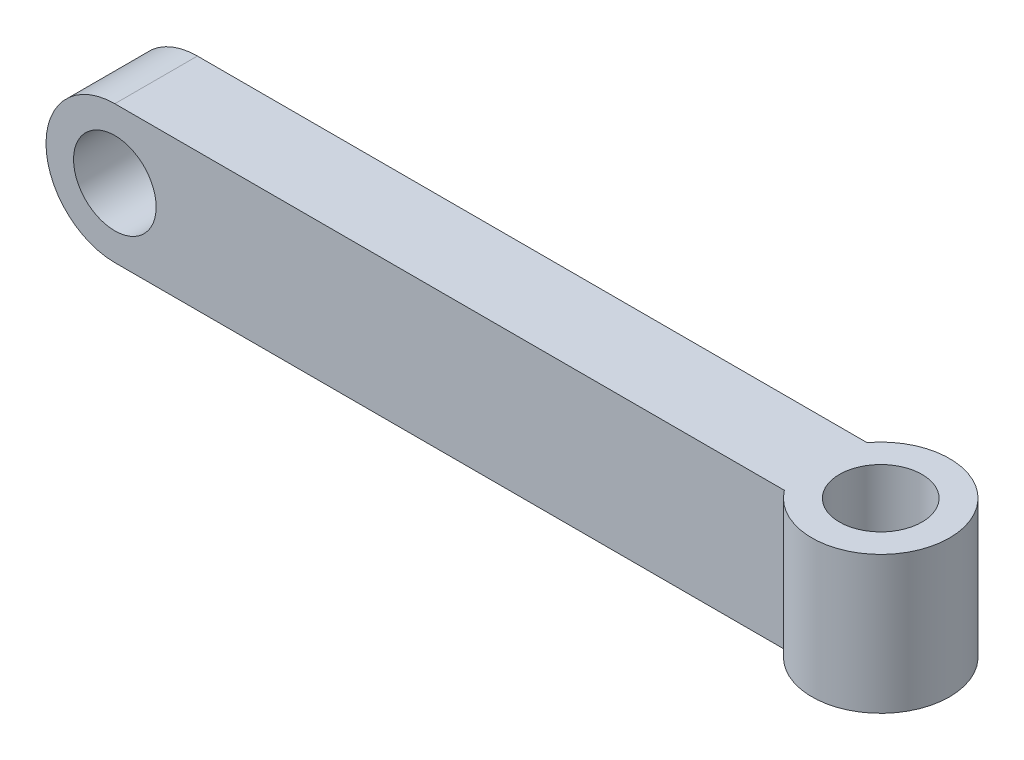
from build123d import *

# Parameters (mm, degrees)
SKETCH_1_W           = 62.64
SKETCH_1_H           = 10
EXTRUDE_2_DEPTH      = 10
SKETCH_3_R           = 3
CUT_EXTRUDE_3_DEPTH  = 35.364842499
SKETCH_4_R           = 3
CUT_EXTRUDE_5_DEPTH  = 34.255712291
SKETCH_5_W           = 44.64
SKETCH_5_H           = 2
CUT_EXTRUDE_7_DEPTH  = 35.364842499
CUT_EXTRUDE_8_DEPTH  = 35.364842499
SKETCH_10_R          = 5
EXTRUDE_7_DEPTH      = 10
SKETCH_11_R          = 3
CUT_EXTRUDE_9_DEPTH  = 35.364842499
SKETCH_13_W          = 2
SKETCH_13_H          = 10
CUT_EXTRUDE_11_DEPTH = 54.814213736


with BuildPart() as part:
    # 草图1 → 凸台-拉伸2 (new body)
    with BuildSketch(Plane.XY):
        Rectangle(SKETCH_1_W, SKETCH_1_H)
    extrude(amount=EXTRUDE_2_DEPTH)

    # 草图3 → 切除-拉伸3 (cut, through all)
    with BuildSketch(Plane(origin=(0, 5, 0), x_dir=(1, 0, 0), z_dir=(0, 1, 0))):
        with BuildLine():
            ThreePointArc((31.32, -5), (29.855533906, -8.535533906), (26.32, -10))
            Line((26.32, -10), (31.32, -10))
            Line((31.32, -10), (31.32, -5))
        make_face()
        with BuildLine():
            Line((31.32, 0), (26.32, 0))
            ThreePointArc((26.32, 0), (29.855533906, -1.464466094), (31.32, -5))
            Line((31.32, -5), (31.32, 0))
        make_face()
        with Locations(Location((26.32, -5, 0), (0, 0, 270))):
            Circle(SKETCH_3_R)
    extrude(amount=-CUT_EXTRUDE_3_DEPTH, mode=Mode.SUBTRACT)

    # 草图4 → 切除-拉伸5 (cut, through all)
    with BuildSketch(Plane.XY.offset(10)):
        with BuildLine():
            ThreePointArc((-31.32, 0), (-29.855533906, 3.535533906), (-26.32, 5))
            Line((-26.32, 5), (-31.32, 5))
            Line((-31.32, 5), (-31.32, 0))
        make_face()
        with BuildLine():
            ThreePointArc((-26.32, -5), (-29.855533906, -3.535533906), (-31.32, 0))
            Line((-31.32, 0), (-31.32, -5))
            Line((-31.32, -5), (-26.32, -5))
        make_face()
        with Locations((-26.32, 0)):
            Circle(SKETCH_4_R)
    extrude(amount=-CUT_EXTRUDE_5_DEPTH, mode=Mode.SUBTRACT)

    # 草图5 → 切除-拉伸7 (cut, through all)
    with BuildSketch(Plane(origin=(0, 5, 0), x_dir=(1, 0, 0), z_dir=(0, 1, 0))):
        with Locations((1, -9)):
            Rectangle(SKETCH_5_W, SKETCH_5_H)
        with Locations((1, -1)):
            Rectangle(SKETCH_5_W, SKETCH_5_H)
    extrude(amount=-CUT_EXTRUDE_7_DEPTH, mode=Mode.SUBTRACT)

    # 草图6 → 切除-拉伸8 (cut, through all)
    with BuildSketch(Plane(origin=(0, 5, 0), x_dir=(1, 0, 0), z_dir=(0, 1, 0))):
        with BuildLine():
            Line((23.32, 0), (23.32, -1))
            ThreePointArc((23.32, -1), (24.73886117, -0.25658351), (26.32, 0))
            Line((26.32, 0), (23.32, 0))
        make_face()
        with BuildLine():
            ThreePointArc((26.32, -10), (24.73886117, -9.74341649), (23.32, -9))
            Line((23.32, -9), (23.32, -10))
            Line((23.32, -10), (26.32, -10))
        make_face()
    extrude(amount=-CUT_EXTRUDE_8_DEPTH, mode=Mode.SUBTRACT)

    # 草图10 → 凸台-拉伸7 (add)
    with BuildSketch(Plane(origin=(0, 5, 0), x_dir=(1, 0, 0), z_dir=(0, 1, 0))):
        with Locations((26.32, -5)):
            Circle(SKETCH_10_R)
    extrude(amount=-EXTRUDE_7_DEPTH)

    # 草图11 → 切除-拉伸9 (cut, through all)
    with BuildSketch(Plane(origin=(0, 5, 0), x_dir=(1, 0, 0), z_dir=(0, 1, 0))):
        with Locations(Location((26.32, -5, 0), (0, 0, 270))):
            Circle(SKETCH_11_R)
    extrude(amount=-CUT_EXTRUDE_9_DEPTH, mode=Mode.SUBTRACT)

    # 草图13 → 切除-拉伸11 (cut, through all)
    with BuildSketch(Plane(origin=(-21.32, 0, 0), x_dir=(0, 0, -1), z_dir=(1, 0, 0))):
        with Locations((-9, 0)):
            Rectangle(SKETCH_13_W, SKETCH_13_H)
        with Locations((-1, 0)):
            Rectangle(SKETCH_13_W, SKETCH_13_H)
    extrude(amount=-CUT_EXTRUDE_11_DEPTH, mode=Mode.SUBTRACT)


solid = part.part
